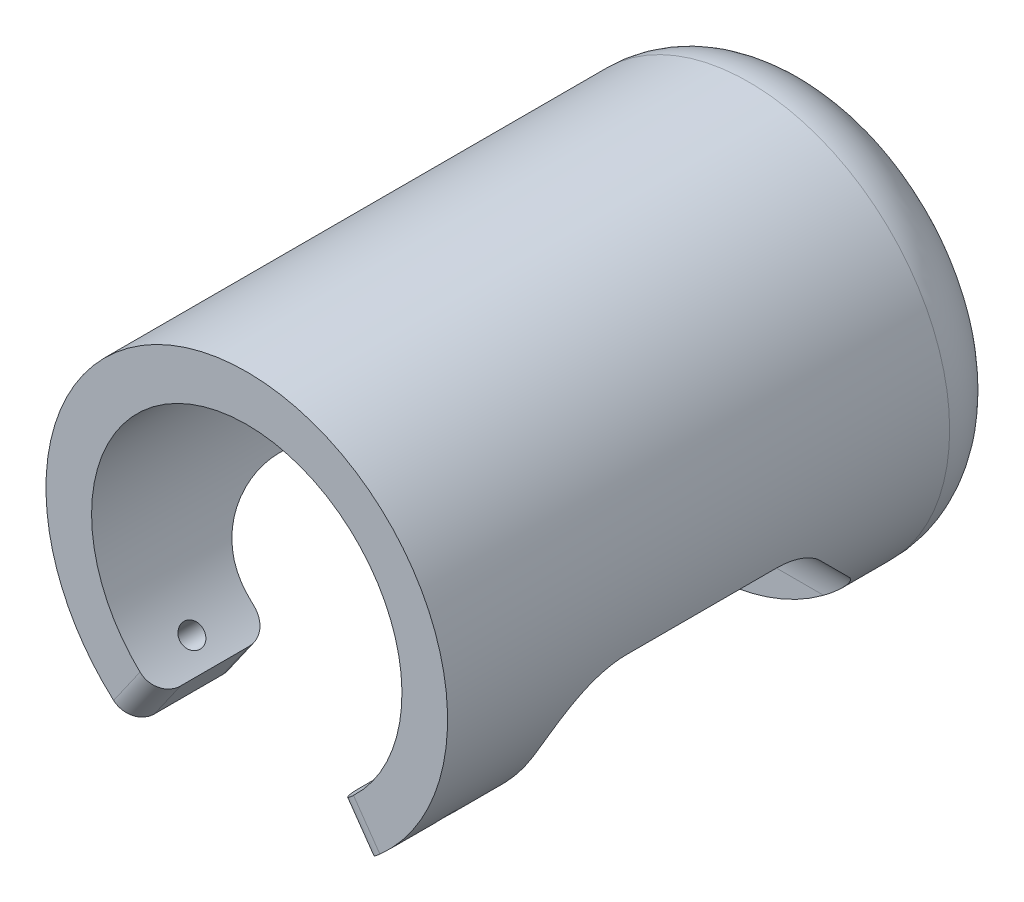
from build123d import *

# Parameters (mm, degrees)
SKETCH_1_R               = 44
EXTRUDE_1_DEPTH          = 62.5
FILLET_1_R               = 15
SHELL_1_T                = -10
CUT_EXTRUDE_1_DEPTH      = 89.194387676
CUT_EXTRUDE_1_DEPTH_BACK = 89.194387676
CUT_EXTRUDE_2_REACH      = 141.632
SKETCH_4_R               = 25
CUT_EXTRUDE_3_DEPTH      = 140.631658364
FILLET_2_R               = 5


with BuildPart() as part:
    # 草图1 → 凸台-拉伸1 (new, symmetric)
    with BuildSketch(Plane.XY):
        Circle(SKETCH_1_R)
    extrude(amount=EXTRUDE_1_DEPTH, both=True)

    # 圆角1
    fillet_1_edges = [part.edges().sort_by_distance(p)[0] for p in [
        (-44, 0, -62.5),
    ]]
    fillet(fillet_1_edges, radius=FILLET_1_R)

    # 抽壳1
    shell_1_openings = [part.faces().sort_by_distance(p)[0] for p in [
        (0, 0, 62.5),
    ]]
    offset(amount=SHELL_1_T, openings=shell_1_openings, kind=Kind.INTERSECTION)

    # 草图2 → 切除-拉伸1 (cut, two sides: drawn at the far end of the back side and taken through both)
    with BuildSketch(Plane(origin=(0, 0, 0), x_dir=(0, 0, -1), z_dir=(1, 0, 0)).offset(-CUT_EXTRUDE_1_DEPTH_BACK)):
        with BuildLine():
            Line((-37.5, -44), (-37.5, -23))
            ThreePointArc((-37.5, -23), (-33.106601718, -12.393398282), (-22.5, -8))
            Line((-22.5, -8), (10.286796564, -8))
            ThreePointArc((10.286796564, -8), (16.02704805, -9.141807012), (20.893398282, -12.393398282))
            Line((20.893398282, -12.393398282), (33.106601718, -24.606601718))
            ThreePointArc((33.106601718, -24.606601718), (36.358192988, -29.47295195), (37.5, -35.213203436))
            Line((37.5, -35.213203436), (37.5, -44))
            Line((37.5, -44), (-37.5, -44))
        make_face()
    extrude(amount=CUT_EXTRUDE_1_DEPTH + CUT_EXTRUDE_1_DEPTH_BACK, mode=Mode.SUBTRACT)

    # 草图3 → 切除-拉伸2 (cut, up to next)
    with BuildSketch(Plane.XY.offset(62.5), mode=Mode.PRIVATE) as cut_extrude_2_sk1:
        with BuildLine():
            Line((19.501598836, -27.851169506), (25.237363199, -36.042689949))
            ThreePointArc((25.237363199, -36.042689949), (0, -44), (-25.237363199, -36.042689949))
            Line((-25.237363199, -36.042689949), (-19.501598836, -27.851169506))
            ThreePointArc((-19.501598836, -27.851169506), (0, -34), (19.501598836, -27.851169506))
        make_face()
    cut_extrude_2_tool1 = extrude(cut_extrude_2_sk1.sketch, amount=-CUT_EXTRUDE_2_REACH, mode=Mode.PRIVATE) & part.part
    add(cut_extrude_2_tool1.solids().sort_by_distance((0, -36.819971, 62.5))[0], mode=Mode.SUBTRACT)

    # 草图4 → 切除-拉伸3 (cut, through all)
    with BuildSketch(Plane.XY.offset(62.5)):
        Circle(SKETCH_4_R)
    extrude(amount=-CUT_EXTRUDE_3_DEPTH, mode=Mode.SUBTRACT)

    # 圆角2
    fillet_2_edges = [part.edges().sort_by_distance(p)[0] for p in [
        (22.369481018, -31.946929727, 37.5),
        (-22.369481018, -31.946929727, 37.5),
        (-22.369481018, -31.946929727, 62.5),
        (22.369481018, -31.946929727, 62.5),
    ]]
    fillet(fillet_2_edges, radius=FILLET_2_R)

    # 草图6 → 切除-旋转1 (revolve, cut)
    with BuildSketch(Plane.XY.offset(50.5), mode=Mode.PRIVATE) as cut_revolve_1_sk:
        Polygon((0, 0), (1.767766953, 1.767766953), (56.3134362, -52.777902294), (54.545669247, -54.545669247), align=None)
    cut_revolve_1 = revolve(cut_revolve_1_sk.sketch.rotate(Axis((0, 0, 50.5), (0.7071067811865438, -0.7071067811865512, 0)), 180), axis=Axis((0, 0, 50.5), (0.7071067811865438, -0.7071067811865512, 0)), mode=Mode.SUBTRACT)

    # 镜向2: 切除-旋转1 across plane
    add(cut_revolve_1.mirror(Plane(origin=(0, 0, 0), x_dir=(0, 0, 1), z_dir=(1, 0, 0))), mode=Mode.SUBTRACT)


solid = part.part
